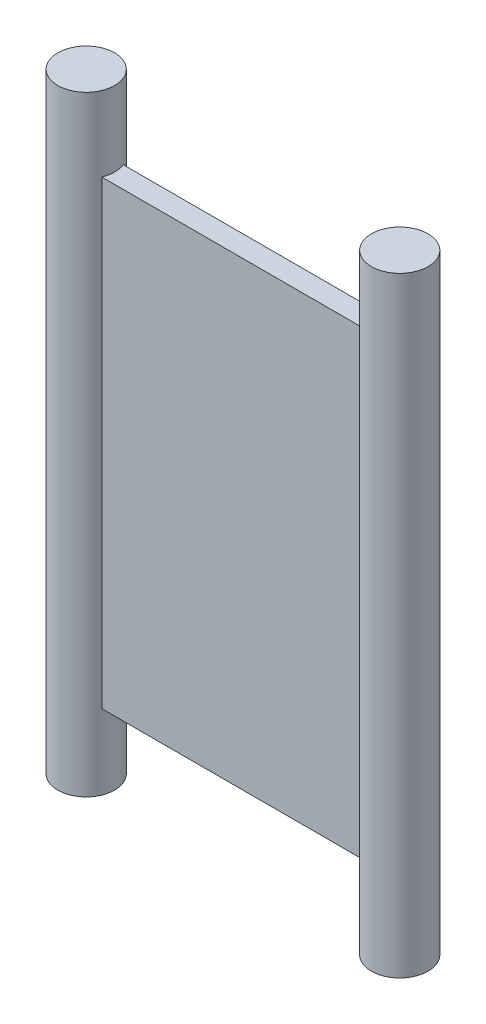
from build123d import *

# Parameters (mm, degrees)
SKETCH1_W           = 14.643
SKETCH1_H           = 1
BOSS_EXTRUDE1_DEPTH = 21.5
SKETCH2_R           = 1.325
BOSS_EXTRUDE2_DEPTH = 14.25


with BuildPart() as part:
    # Sketch1 → Boss-Extrude1 (new body)
    with BuildSketch(Plane(origin=(0, 0, 0), x_dir=(1, 0, 0), z_dir=(0, 1, 0))):
        Rectangle(SKETCH1_W, SKETCH1_H)
    extrude(amount=BOSS_EXTRUDE1_DEPTH)

    # Sketch2 → Boss-Extrude2 (add, symmetric)
    with BuildSketch(Plane(origin=(0, 10.75, 0), x_dir=(1, 0, 0), z_dir=(0, 1, 0))):
        with Locations(Location((-7.3215, 0, 0), (0, 0, 270))):
            Circle(SKETCH2_R)
        with Locations(Location((7.3215, 0, 0), (0, 0, 270))):
            Circle(SKETCH2_R)
    extrude(amount=BOSS_EXTRUDE2_DEPTH, both=True)


solid = part.part
